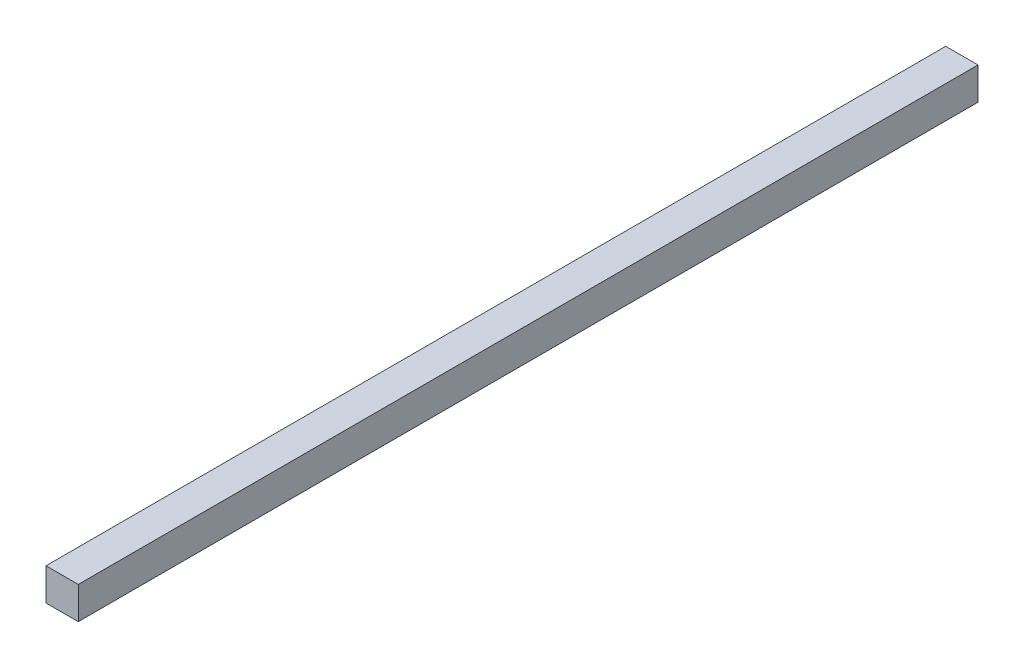
from build123d import *

# Parameters (mm, degrees)
SKETCH_1_W      = 14.349018657
SKETCH_1_H      = 14.349018657
EXTRUDE_1_DEPTH = 400


with BuildPart() as part:
    # 草图1 → 凸台-拉伸1 (new body)
    with BuildSketch(Plane.XY):
        with Locations((-14.592222363, 11.18240278)):
            Rectangle(SKETCH_1_W, SKETCH_1_H)
    extrude(amount=EXTRUDE_1_DEPTH)


solid = part.part
